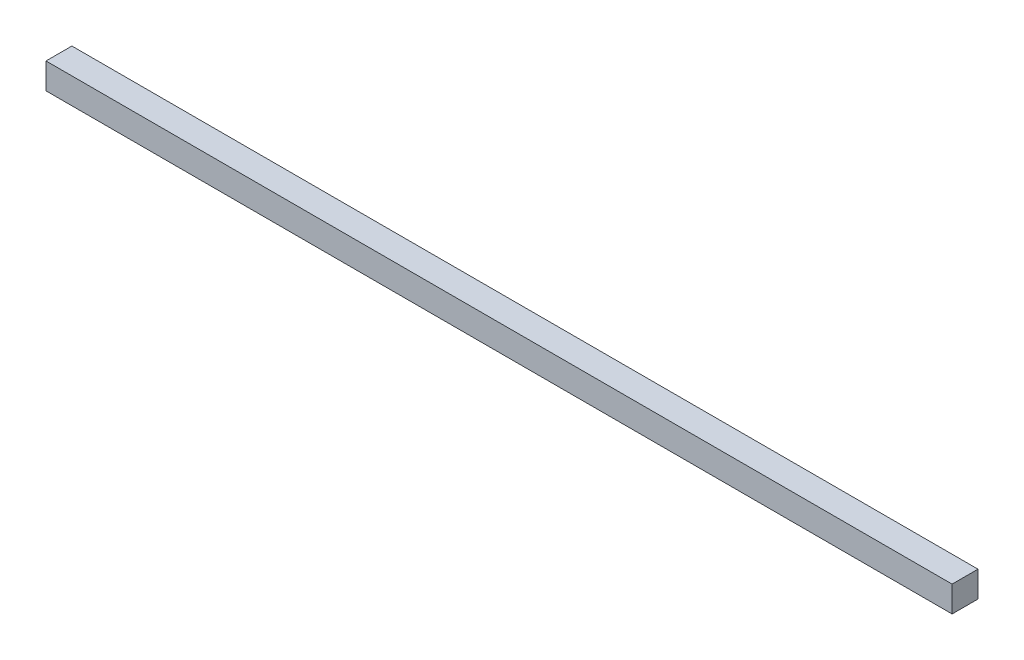
from build123d import *

# Parameters (mm, degrees)
SKETCH1_W           = 88.9
SKETCH1_H           = 2.54
BOSS_EXTRUDE1_DEPTH = 2.54


with BuildPart() as part:
    # Sketch1 → Boss-Extrude1 (new body)
    with BuildSketch(Plane.XY):
        with Locations((11.452566634, 9.524373149)):
            Rectangle(SKETCH1_W, SKETCH1_H)
    extrude(amount=BOSS_EXTRUDE1_DEPTH)


solid = part.part
